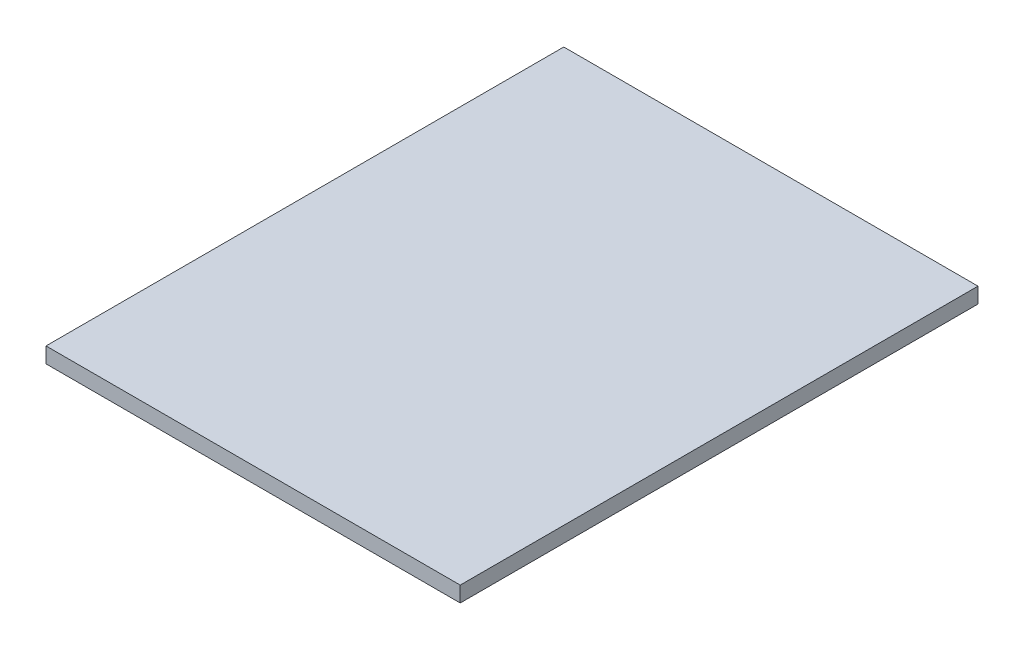
from build123d import *

# Parameters (mm, degrees)
SKETCH1_W           = 20
SKETCH1_H           = 25
BOSS_EXTRUDE1_DEPTH = 0.75


with BuildPart() as part:
    # Sketch1 → Boss-Extrude1 (new body)
    with BuildSketch(Plane(origin=(0, 0, 0), x_dir=(1, 0, 0), z_dir=(0, 1, 0))):
        with Locations((10.4, -2)):
            Rectangle(SKETCH1_W, SKETCH1_H)
    extrude(amount=BOSS_EXTRUDE1_DEPTH)


solid = part.part
